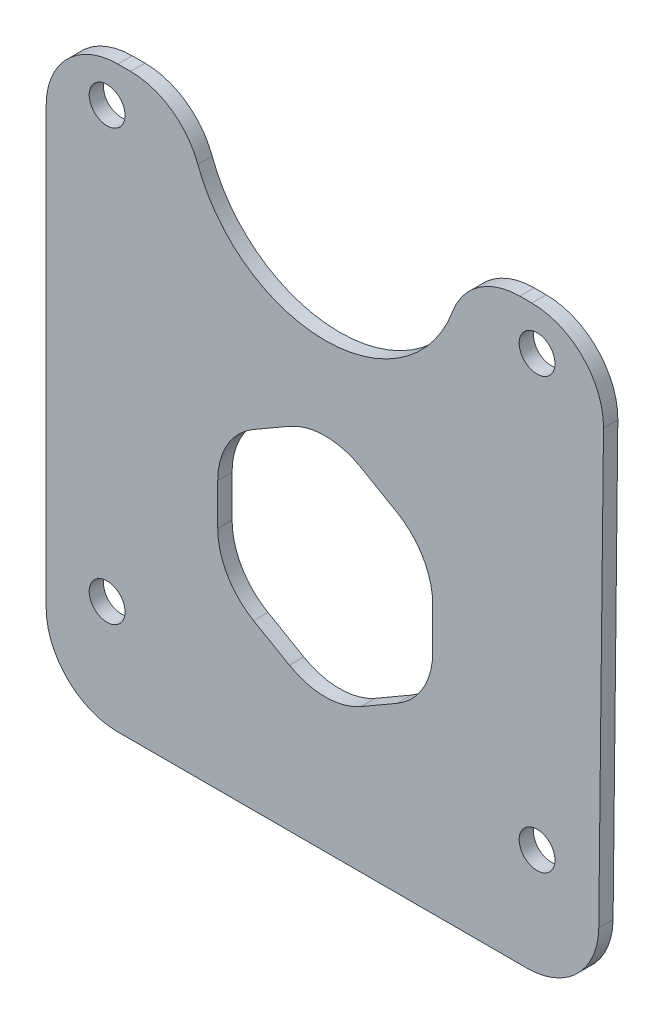
from build123d import *

# Parameters (mm, degrees)
SKETCH1_W           = 117
SKETCH1_H           = 200
BOSS_EXTRUDE1_DEPTH = 2
CUT_EXTRUDE1_DEPTH  = 2
SKETCH3_R           = 2.5
SKETCH3_R_2         = 1.5
SKETCH3_R_3         = 12.5
CUT_EXTRUDE2_DEPTH  = 30
FILLET1_R           = 20
CUT_EXTRUDE3_DEPTH  = 10
FILLET2_R           = 10
CUT_EXTRUDE4_DEPTH  = 10
FILLET3_R           = 10
CUT_EXTRUDE5_DEPTH  = 10
FILLET4_R           = 10


with BuildPart() as part:
    # Sketch1 → Boss-Extrude1 (new body)
    with BuildSketch(Plane.XY):
        with Locations((58.5, 100)):
            Rectangle(SKETCH1_W, SKETCH1_H)
    extrude(amount=BOSS_EXTRUDE1_DEPTH)

    # Sketch2 → Cut-Extrude1 (cut)
    with BuildSketch(Plane.XY.offset(2)):
        Polygon((0, 120), (40, 200), (0, 200), align=None)
        Polygon((77, 200), (117, 120), (117, 200), align=None)
    extrude(amount=-CUT_EXTRUDE1_DEPTH, mode=Mode.SUBTRACT)

    # Sketch3 → Cut-Extrude2 (cut)
    with BuildSketch(Plane.XY.offset(2)):
        with Locations((58.5, 170)):
            Circle(SKETCH3_R)
        with Locations((58.5, 150)):
            Circle(SKETCH3_R)
        with Locations((28.5, 15)):
            Circle(SKETCH3_R)
        with Locations((88.5, 15)):
            Circle(SKETCH3_R)
        with Locations((28.5, 75)):
            Circle(SKETCH3_R)
        with Locations((88.5, 75)):
            Circle(SKETCH3_R)
        with Locations((43, 112.5)):
            Circle(SKETCH3_R_2)
        with Locations((43, 81.5)):
            Circle(SKETCH3_R_2)
        with Locations((74, 81.5)):
            Circle(SKETCH3_R_2)
        with Locations((74, 112.5)):
            Circle(SKETCH3_R_2)
        with Locations((58.5, 97)):
            Circle(SKETCH3_R_3)
    extrude(amount=-CUT_EXTRUDE2_DEPTH, mode=Mode.SUBTRACT)

    # Fillet1
    fillet1_edges = [part.edges().sort_by_distance(p)[0] for p in [
        (0, 120, 1),
        (40, 200, 1),
        (117, 120, 1),
        (77, 200, 1),
        (117, 0, 1),
        (0, 0, 1),
    ]]
    fillet(fillet1_edges, radius=FILLET1_R)

    # Sketch4 → Cut-Extrude3 (cut)
    with BuildSketch(Plane(origin=(0, 0, 0), x_dir=(-1, 0, 0), z_dir=(0, 0, -1))):
        with BuildLine():
            Line((-97, 0), (-98.708203932, 156.583592135))
            Line((-98.708203932, 156.583592135), (-114.88854382, 124.22291236))
            ThreePointArc((-114.88854382, 124.22291236), (-116.464979789, 119.873698861), (-117, 115.27864045))
            Line((-117, 115.27864045), (-117, 20))
            ThreePointArc((-117, 20), (-111.142135624, 5.857864376), (-97, 0))
        make_face()
        with BuildLine():
            Line((-20, 0), (-20, 160))
            Line((-20, 160), (-18.291796068, 156.583592135))
            Line((-18.291796068, 156.583592135), (-2.11145618, 124.22291236))
            ThreePointArc((-2.11145618, 124.22291236), (-0.535020211, 119.873698861), (0, 115.27864045))
            Line((0, 115.27864045), (0, 20))
            ThreePointArc((0, 20), (-5.857864376, 5.857864376), (-20, 0))
        make_face()
    extrude(amount=-CUT_EXTRUDE3_DEPTH, mode=Mode.SUBTRACT)

    # Fillet2
    fillet2_edges = [part.edges().sort_by_distance(p)[0] for p in [
        (97, 0, 1),
        (20, 0, 1),
        (98.708203932, 156.583592135, 1),
        (20, 160, 1),
    ]]
    fillet(fillet2_edges, radius=FILLET2_R)

    # Sketch5 → Cut-Extrude4 (cut)
    with BuildSketch(Plane(origin=(0, 0, 0), x_dir=(-1, 0, 0), z_dir=(0, 0, -1))):
        with BuildLine():
            Line((-97.880566934, 80.717724073), (-77.880566934, 80.717724073))
            ThreePointArc((-77.880566934, 80.717724073), (-58.940283467, 61.777440606), (-40, 80.717724073))
            Line((-40, 80.717724073), (-20, 80.717724073))
            Line((-20, 80.717724073), (-20, 83.819660113))
            Line((-20, 83.819660113), (-20, 157.639320225))
            ThreePointArc((-20, 157.639320225), (-20.267510105, 159.93684943), (-21.05572809, 162.11145618))
            Line((-21.05572809, 162.11145618), (-34.472135955, 188.94427191))
            ThreePointArc((-34.472135955, 188.94427191), (-41.846057533, 197.013016167), (-52.360679775, 200))
            Line((-52.360679775, 200), (-64.639320225, 200))
            ThreePointArc((-64.639320225, 200), (-75.153942467, 197.013016167), (-82.527864045, 188.94427191))
            Line((-82.527864045, 188.94427191), (-97.626690246, 158.746619509))
            ThreePointArc((-97.626690246, 158.746619509), (-98.427295018, 156.518894044), (-98.681823334, 154.165397904))
            Line((-98.681823334, 154.165397904), (-97.894862718, 82.028156127))
            Line((-97.894862718, 82.028156127), (-97.880566934, 80.717724073))
        make_face()
    extrude(amount=-CUT_EXTRUDE4_DEPTH, mode=Mode.SUBTRACT)

    # Fillet3
    fillet3_edges = [part.edges().sort_by_distance(p)[0] for p in [
        (40, 80.717724073, 1),
        (77.880566934, 80.717724073, 1),
        (20, 80.717724073, 1),
        (97.880566934, 80.717724073, 1),
    ]]
    fillet(fillet3_edges, radius=FILLET3_R)

    # Sketch6 → Cut-Extrude5 (cut)
    with BuildSketch(Plane(origin=(0, 0, 0), x_dir=(-1, 0, 0), z_dir=(0, 0, -1))):
        Polygon((-58.940283467, 51.794857369), (-73.940283467, 43.134603332), (-73.940283467, 25.814095256), (-58.940283467, 17.153841218), (-43.940283467, 25.814095256), (-43.940283467, 43.134603332), align=None)
    extrude(amount=-CUT_EXTRUDE5_DEPTH, mode=Mode.SUBTRACT)

    # Fillet4
    fillet4_edges = [part.edges().sort_by_distance(p)[0] for p in [
        (58.940283467, 51.794857369, 1),
        (43.940283467, 43.134603332, 1),
        (43.940283467, 25.814095256, 1),
        (58.940283467, 17.153841218, 1),
        (73.940283467, 25.814095256, 1),
        (73.940283467, 43.134603332, 1),
    ]]
    fillet(fillet4_edges, radius=FILLET4_R)


solid = part.part
